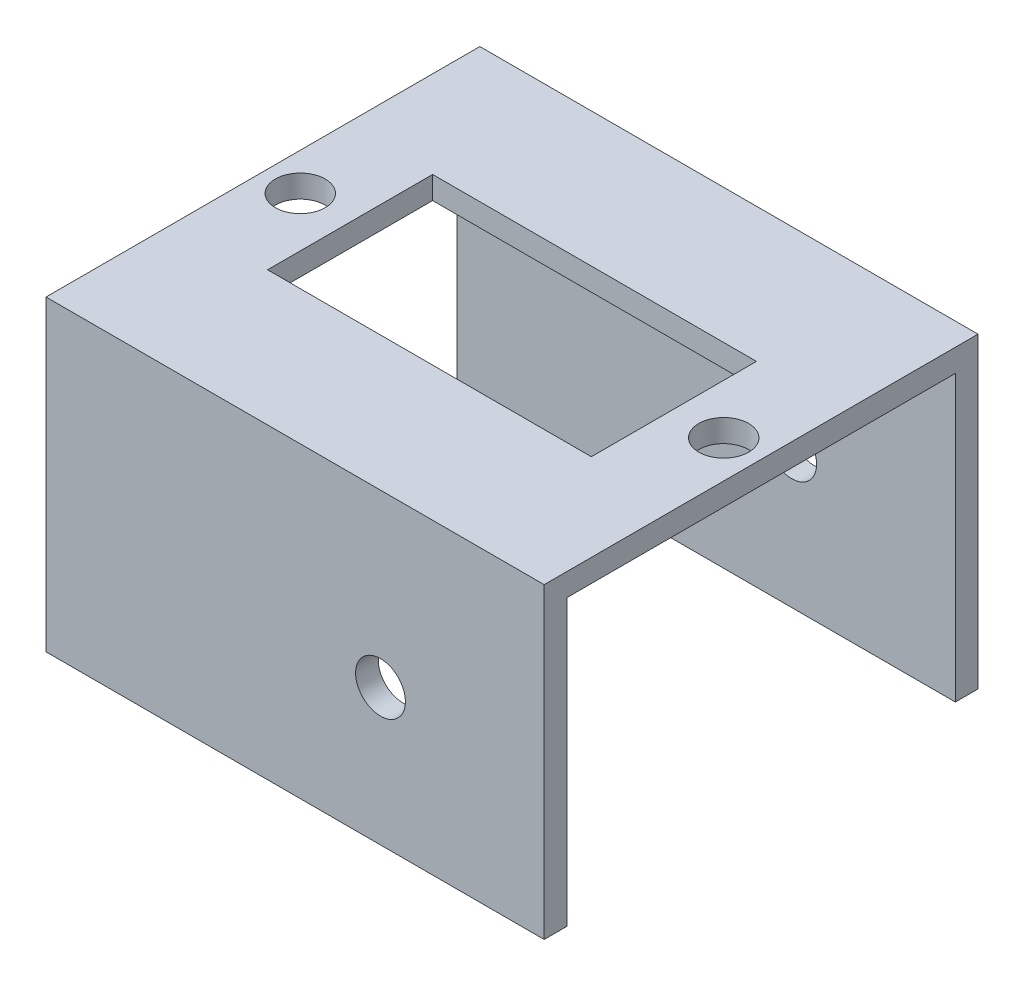
from build123d import *

# Parameters (mm, degrees)
SKETCH1_W           = 45
SKETCH1_H           = 30.48
SKETCH1_R           = 1.75
SKETCH1_W_2         = 22.75
SKETCH1_H_2         = 11.6
BOSS_EXTRUDE1_DEPTH = 1.59
SKETCH3_W           = 45
SKETCH3_H           = 1.59
BOSS_EXTRUDE3_DEPTH = 20
SKETCH4_R           = 1.75
CUT_EXTRUDE2_DEPTH  = 40
SKETCH5_W           = 5
SKETCH5_H           = 30.48
CUT_EXTRUDE3_DEPTH  = 30


with BuildPart() as part:
    # Sketch1 → Boss-Extrude1 (new body)
    with BuildSketch(Plane(origin=(0, 0, 0), x_dir=(1, 0, 0), z_dir=(0, 1, 0))):
        Rectangle(SKETCH1_W, SKETCH1_H)
        with Locations(Location((-14.875, 0, 0), (0, 0, 90))):
            Circle(SKETCH1_R, mode=Mode.SUBTRACT)
        with Locations(Location((14.875, 0, 0), (0, 0, 90))):
            Circle(SKETCH1_R, mode=Mode.SUBTRACT)
        Rectangle(SKETCH1_W_2, SKETCH1_H_2, mode=Mode.SUBTRACT)
    extrude(amount=BOSS_EXTRUDE1_DEPTH)

    # Sketch3 → Boss-Extrude3 (add)
    with BuildSketch(Plane(origin=(0, 0, 0), x_dir=(-1, 0, 0), z_dir=(0, -1, 0))):
        with Locations((0, -14.445)):
            Rectangle(SKETCH3_W, SKETCH3_H)
        with Locations((0, 14.445)):
            Rectangle(SKETCH3_W, SKETCH3_H)
    extrude(amount=BOSS_EXTRUDE3_DEPTH)

    # Sketch4 → Cut-Extrude2 (cut)
    with BuildSketch(Plane.XY.offset(15.24)):
        with Locations((6, -10.41)):
            Circle(SKETCH4_R)
    extrude(amount=-CUT_EXTRUDE2_DEPTH, mode=Mode.SUBTRACT)

    # Sketch5 → Cut-Extrude3 (cut)
    with BuildSketch(Plane(origin=(0, 1.59, 0), x_dir=(1, 0, 0), z_dir=(0, 1, 0))):
        with Locations((-20, 0)):
            Rectangle(SKETCH5_W, SKETCH5_H)
        with Locations((20, 0)):
            Rectangle(SKETCH5_W, SKETCH5_H)
    extrude(amount=-CUT_EXTRUDE3_DEPTH, mode=Mode.SUBTRACT)


solid = part.part
